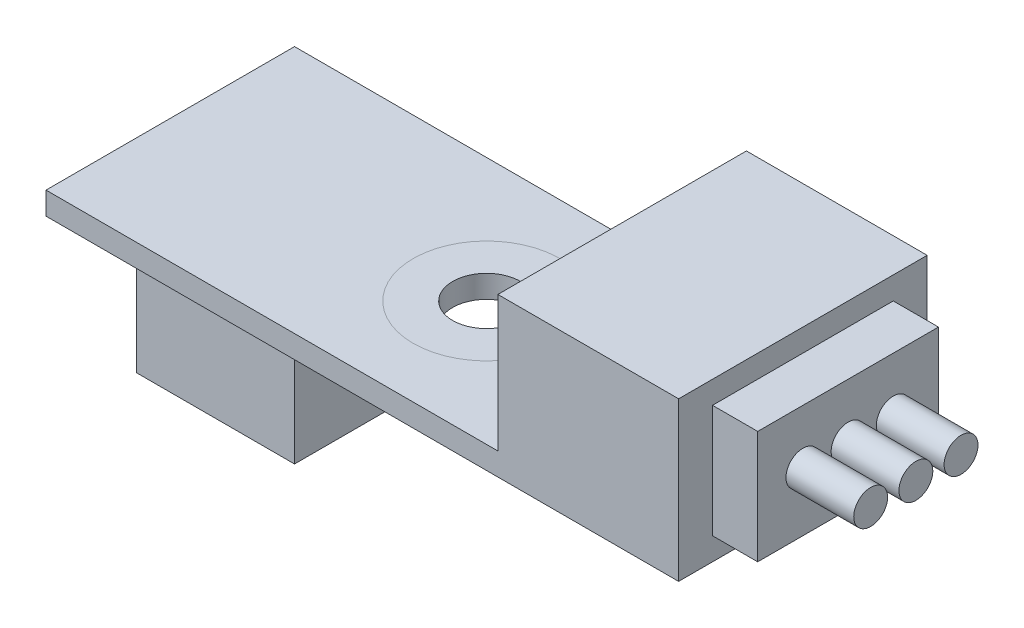
from build123d import *

# Parameters (mm, degrees)
SKETCH1_W           = 20
SKETCH1_H           = 11
SKETCH1_W_2         = 7
SKETCH1_H_2         = 5
SKETCH1_R           = 3.25
SKETCH1_R_2         = 1.5
SKETCH1_W_3         = 8
BOSS_EXTRUDE1_DEPTH = 1
SKETCH1_3_W         = 7
SKETCH1_3_H         = 5
BOSS_EXTRUDE2_DEPTH = 7
BOSS_EXTRUDE3_START = 1
SKETCH1_4_W         = 8
SKETCH1_4_H         = 11
BOSS_EXTRUDE3_DEPTH = 6
SKETCH3_W           = 8
SKETCH3_H           = 5
BOSS_EXTRUDE4_DEPTH = 2
SKETCH4_R           = 0.75
BOSS_EXTRUDE6_DEPTH = 3


with BuildPart() as part:
    # Sketch1 → Boss-Extrude1 (new body)
    # profile 1 of 4: a face of its own
    with BuildSketch(Plane(origin=(0, 0, 0), x_dir=(1, 0, 0), z_dir=(0, 1, 0))):
        with Locations((-4, 0)):
            Rectangle(SKETCH1_W, SKETCH1_H)
        with Locations((-9.5, 0)):
            Rectangle(SKETCH1_W_2, SKETCH1_H_2, mode=Mode.SUBTRACT)
        Circle(SKETCH1_R, mode=Mode.SUBTRACT)
    # profile 2 of 4: a face of its own
    with BuildSketch(Plane(origin=(0, 0, 0), x_dir=(1, 0, 0), z_dir=(0, 1, 0))):
        with Locations((-9.5, 0)):
            Rectangle(SKETCH1_W_2, SKETCH1_H_2)
    # profile 3 of 4: a face of its own
    with BuildSketch(Plane(origin=(0, 0, 0), x_dir=(1, 0, 0), z_dir=(0, 1, 0))):
        Circle(SKETCH1_R)
        with Locations(Location((0, 0, 0), (0, 0, 270))):
            Circle(SKETCH1_R_2, mode=Mode.SUBTRACT)
    # profile 4 of 4: a face of its own
    with BuildSketch(Plane(origin=(0, 0, 0), x_dir=(1, 0, 0), z_dir=(0, 1, 0))):
        with Locations((10, 0)):
            Rectangle(SKETCH1_W_3, SKETCH1_H)
    extrude(amount=BOSS_EXTRUDE1_DEPTH)

    # Sketch1<3> → Boss-Extrude2 (add)
    with BuildSketch(Plane(origin=(0, 0, 0), x_dir=(1, 0, 0), z_dir=(0, 1, 0))):
        with Locations((-9.5, 0)):
            Rectangle(SKETCH1_3_W, SKETCH1_3_H)
    extrude(amount=-BOSS_EXTRUDE2_DEPTH)

    # Sketch1<4> → Boss-Extrude3 (add)
    with BuildSketch(Plane(origin=(0, 0, 0), x_dir=(1, 0, 0), z_dir=(0, 1, 0)).offset(BOSS_EXTRUDE3_START)):
        with Locations((10, 0)):
            Rectangle(SKETCH1_4_W, SKETCH1_4_H)
    extrude(amount=BOSS_EXTRUDE3_DEPTH)

    # Sketch3 → Boss-Extrude4 (add)
    with BuildSketch(Plane(origin=(14, 0, 0), x_dir=(0, 0, -1), z_dir=(1, 0, 0))):
        with Locations((0, 3.5)):
            Rectangle(SKETCH3_W, SKETCH3_H)
    extrude(amount=BOSS_EXTRUDE4_DEPTH)

    # Sketch4 → Boss-Extrude6 (add)
    with BuildSketch(Plane(origin=(16, 0, 0), x_dir=(0, 0, -1), z_dir=(1, 0, 0))):
        with Locations(Location((-2, 3.603838689, 0), (0, 0, 180))):
            Circle(SKETCH4_R)
        with Locations(Location((0, 3.603838689, 0), (0, 0, 180))):
            Circle(SKETCH4_R)
        with Locations(Location((2, 3.603838689, 0), (0, 0, 180))):
            Circle(SKETCH4_R)
    extrude(amount=BOSS_EXTRUDE6_DEPTH)


solid = part.part
